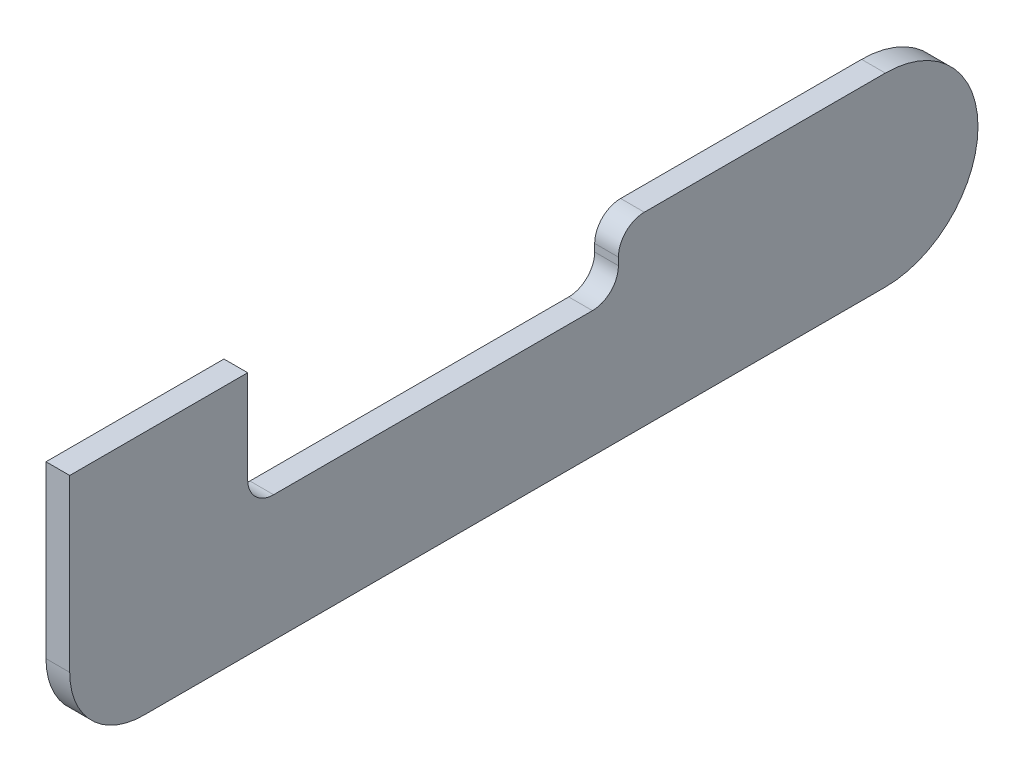
from build123d import *

# Parameters (mm, degrees)
AUFSATZ_LINEAR_AUSTRAGEN1_DEPTH = 1.6


with BuildPart() as part:
    # Skizze1 → Aufsatz-Linear austragen1 (new body)
    with BuildSketch(Plane(origin=(0, 0, 0), x_dir=(0, 0, -1), z_dir=(1, 0, 0))):
        with BuildLine():
            Line((45, -12.5), (95, -12.5))
            ThreePointArc((95, -12.5), (101.25, -6.25), (95, 0))
            Line((95, 0), (78.75, 0))
            ThreePointArc((78.75, 0), (77.512563133, -0.512563133), (77, -1.75))
            Line((77, -1.75), (77, -2.25))
            ThreePointArc((77, -2.25), (76.487436867, -3.487436867), (75.25, -4))
            Line((75.25, -4), (53.75, -4))
            ThreePointArc((53.75, -4), (52.512563133, -3.487436867), (52, -2.25))
            Line((52, -2.25), (52, 4))
            Line((52, 4), (40, 4))
            Line((40, 4), (40, -4))
            Line((40, -4), (40, -7.5))
            ThreePointArc((40, -7.5), (41.464466094, -11.035533906), (45, -12.5))
        make_face()
    extrude(amount=AUFSATZ_LINEAR_AUSTRAGEN1_DEPTH)


solid = part.part
